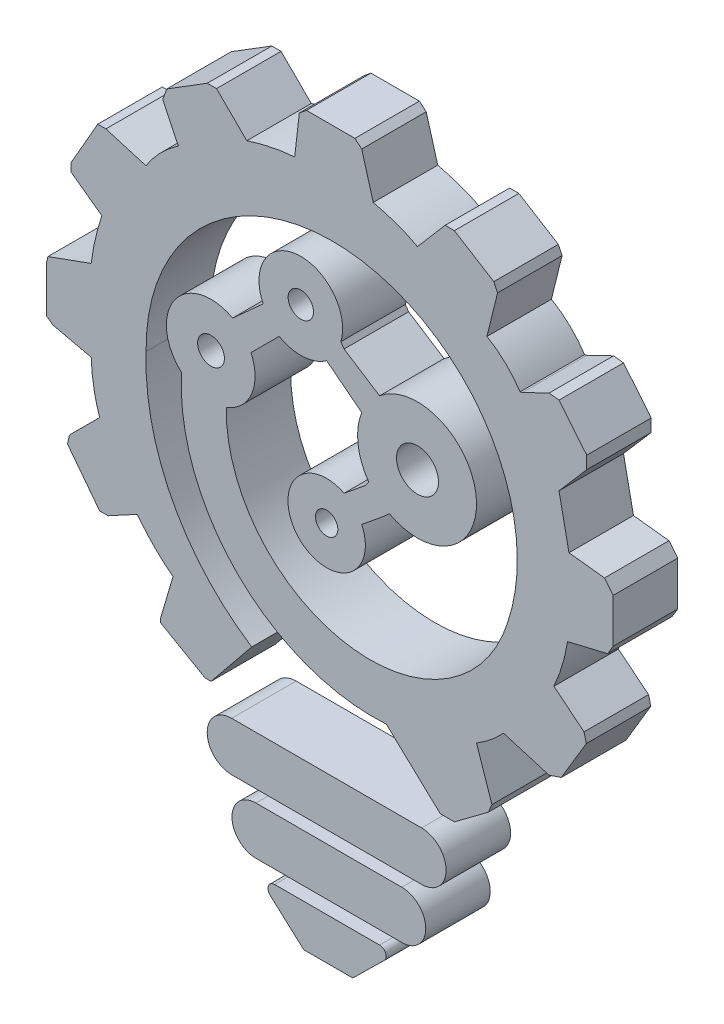
from build123d import *

# Parameters (mm, degrees)
BOSS_EXTRUDE1_DEPTH   = 10
BOSS_EXTRUDE1_2_DEPTH = 10
BOSS_EXTRUDE1_3_DEPTH = 10
SKETCH1_R             = 1.735714146
SKETCH1_R_2           = 3.25388296
SKETCH1_R_3           = 1.963199763
SKETCH1_R_4           = 2.077188844
BOSS_EXTRUDE1_4_DEPTH = 10
CUT_EXTRUDE2_DEPTH    = 3.5


with BuildPart() as part:
    # Sketch1 → Boss-Extrude1 (new body)
    with BuildSketch(Plane.XY):
        with BuildLine():
            Line((36.612676513, 50.128115897), (66.063908948, 50.128115897))
            ThreePointArc((66.063908948, 50.128115897), (69.85606523, 46.335959615), (66.063908948, 42.543803333))
            Line((66.063908948, 42.543803333), (36.612676513, 42.543803333))
            ThreePointArc((36.612676513, 42.543803333), (32.82052023, 46.335959615), (36.612676513, 50.128115897))
        make_face()
    extrude(amount=BOSS_EXTRUDE1_DEPTH)


with BuildPart() as body_2:
    # Sketch1 → Boss-Extrude1 2 (new body)
    with BuildSketch(Plane.XY):
        with BuildLine():
            Line((40.371121954, 40.631857622), (62.992183574, 40.631857622))
            ThreePointArc((62.992183574, 40.631857622), (66.703998638, 36.920042558), (62.992183574, 33.208227494))
            Line((62.992183574, 33.208227494), (40.371121954, 33.208227494))
            ThreePointArc((40.371121954, 33.208227494), (36.65930689, 36.920042558), (40.371121954, 40.631857622))
        make_face()
    extrude(amount=BOSS_EXTRUDE1_2_DEPTH)


with BuildPart() as body_3:
    # Sketch1 → Boss-Extrude1 3 (new body)
    with BuildSketch(Plane.XY):
        with BuildLine():
            Line((43.291590681, 31.145459419), (59.548762461, 31.145459419))
            ThreePointArc((59.548762461, 31.145459419), (60.47915555, 30.526270831), (60.255275906, 29.431326214))
            Line((60.255275906, 29.431326214), (55.380256876, 24.642590707))
            Line((55.380256876, 24.642590707), (47.793576713, 24.642590707))
            Line((47.793576713, 24.642590707), (42.554783621, 29.366497269))
            ThreePointArc((42.554783621, 29.366497269), (42.328835394, 30.502145791), (43.291590681, 31.145459419))
        make_face()
    extrude(amount=BOSS_EXTRUDE1_3_DEPTH)


with BuildPart() as body_4:
    # Sketch1 → Boss-Extrude1 4 (new body)
    with BuildSketch(Plane.XY):
        with BuildLine():
            Line((54.042424699, 89.057178574), (57.338263311, 91.74525403))
            Line((57.338263311, 91.74525403), (57.858109934, 92.482001406))
            ThreePointArc((57.858109934, 92.482001406), (56.203750586, 96.735543385), (56.775287603, 101.263552843))
            Line((56.775287603, 101.263552843), (51.33821868, 105.502853511))
            ThreePointArc((51.33821868, 105.502853511), (47.717753365, 104.214223221), (43.975219744, 105.087022863))
            Line((43.975219744, 105.087022863), (39.619407743, 100.731210862))
            ThreePointArc((39.619407743, 100.731210862), (39.726080925, 95.257490785), (35.780591664, 91.461953256))
            ThreePointArc((35.780591664, 91.461953256), (54.470931261, 69.004961782), (79.367543752, 84.29561078))
            ThreePointArc((79.367543752, 84.29561078), (78.518157241, 104.885379157), (63.999024785, 119.509154728))
            ThreePointArc((63.999024785, 119.509154728), (36.348842887, 117.238880972), (23.350287639, 92.729204038))
            ThreePointArc((23.350287639, 92.729204038), (27.391085677, 74.838212259), (39.726172291, 61.263925027))
            Line((39.726172291, 61.263925027), (33.41222021, 53.484864806))
            Line((33.41222021, 53.484864806), (32.501801001, 53.484864806))
            Line((32.501801001, 53.484864806), (25.600419414, 57.431311375))
            Line((25.600419414, 57.431311375), (25.600419414, 58.091089656))
            Line((25.600419414, 58.091089656), (27.529461306, 64.624845993))
            add(Edge.make_bspline(
                [(27.529461306, 64.624845993), (24.51350433, 66.863878585), (21.96798092, 70.186326379)],
                knots=[0, 0, 0, 1, 1, 1], degree=2))
            Line((21.96798092, 70.186326379), (17.44826512, 67.73638598))
            Line((17.44826512, 67.73638598), (16.147653792, 67.73638598))
            Line((16.147653792, 67.73638598), (11.164001938, 74.227807572))
            Line((11.164001938, 74.227807572), (11.478280842, 75.608236048))
            Line((11.478280842, 75.608236048), (16.147653792, 80.277608998))
            add(Edge.make_bspline(
                [(14.836422664, 87.711108712), (14.969965726, 83.721585295), (16.147653792, 80.277608998)],
                knots=[0, 0, 0, 1, 1, 1], degree=2))
            Line((14.836422664, 87.711108712), (8.923989025, 89.057178574))
            Line((8.923989025, 89.057178574), (7.872310913, 89.823022551))
            Line((7.872310913, 89.823022551), (7.872310913, 96.783792065))
            Line((7.872310913, 96.783792065), (8.120139021, 97.872344214))
            Line((8.120139021, 97.872344214), (14.836422664, 100.309725684))
            ThreePointArc((14.836422664, 100.309725684), (15.482642582, 103.966872263), (16.483280209, 107.543329397))
            Line((16.483280209, 107.543329397), (11.70192116, 111.025169506))
            Line((11.70192116, 111.025169506), (11.70192116, 112.254374343))
            Line((11.70192116, 112.254374343), (15.850453276, 119.509154728))
            Line((15.850453276, 119.509154728), (17.116107143, 119.509154728))
            Line((17.116107143, 119.509154728), (23.350287639, 117.668560326))
            add(Edge.make_bspline(
                [(28.34341676, 122.838084344), (25.083188206, 120.541403415), (23.350287639, 117.668560326)],
                knots=[0, 0, 0, 1, 1, 1], degree=2))
            Line((28.34341676, 122.838084344), (25.924430047, 127.860583288))
            Line((25.924430047, 127.860583288), (26.55905403, 129.601522707))
            Line((26.55905403, 129.601522707), (32.835382419, 133.499504209))
            Line((32.835382419, 133.499504209), (34.268559767, 133.499504209))
            Line((34.268559767, 133.499504209), (38.960915607, 128.841575946))
            add(Edge.make_bspline(
                [(46.383652832, 130.361469468), (43.207748731, 130.193389879), (38.960915607, 128.841575946)],
                knots=[0, 0, 0, 1, 1, 1], degree=2))
            Line((46.383652832, 130.361469468), (47.099801145, 136.637538949))
            Line((47.099801145, 136.637538949), (48.204973985, 137.54371488))
            Line((48.204973985, 137.54371488), (55.716804255, 137.54371488))
            Line((55.716804255, 137.54371488), (56.775287603, 136.637538949))
            Line((56.775287603, 136.637538949), (58.560830407, 130.361469468))
            add(Edge.make_bspline(
                [(65.42141471, 127.860583288), (62.762273281, 129.346820645), (58.560830407, 130.361469468)],
                knots=[0, 0, 0, 1, 1, 1], degree=2))
            Line((65.42141471, 127.860583288), (69.703471426, 132.862355649))
            Line((69.703471426, 132.862355649), (71.141353612, 132.862355649))
            Line((71.141353612, 132.862355649), (77.253367018, 129.076282377))
            Line((77.253367018, 129.076282377), (77.838884302, 127.860583288))
            Line((77.838884302, 127.860583288), (76.183025885, 121.169766859))
            add(Edge.make_bspline(
                [(76.183025885, 121.169766859), (79.253811261, 119.413315061), (81.326289538, 116.311143396)],
                knots=[0, 0, 0, 1, 1, 1], degree=2))
            Line((81.326289538, 116.311143396), (81.695672628, 116.410742944))
            Line((81.695672628, 116.410742944), (85.815355288, 118.394906151))
            Line((85.815355288, 118.394906151), (87.360330483, 118.218612472))
            Line((87.360330483, 118.218612472), (91.659132082, 112.975790841))
            Line((91.659132082, 112.975790841), (91.659132082, 111.025169506))
            Line((91.659132082, 111.025169506), (87.360330483, 106.045624317))
            Line((87.360330483, 106.045624317), (88.905274365, 98.500548104))
            Line((88.905274365, 98.500548104), (94.4129898, 97.87207496))
            Line((94.4129898, 97.87207496), (95.767055319, 96.21186062))
            Line((95.767055319, 96.21186062), (95.767055319, 89.382694603))
            Line((95.767055319, 89.382694603), (94.909859849, 87.946746758))
            Line((94.909859849, 87.946746758), (88.683296287, 86.458456895))
            add(Edge.make_bspline(
                [(88.683296287, 86.458456895), (88.100618882, 82.748375774), (86.564981896, 79.397644229)],
                knots=[0, 0, 0, 1, 1, 1], degree=2))
            Line((86.564981896, 79.397644229), (91.245566834, 75.624301928))
            Line((91.245566834, 75.624301928), (91.598019479, 74.227807572))
            Line((91.598019479, 74.227807572), (87.722936412, 67.73638598))
            Line((87.722936412, 67.73638598), (85.815355288, 67.093511057))
            Line((85.815355288, 67.093511057), (78.775745724, 69.205464306))
            add(Edge.make_bspline(
                [(78.775745724, 69.205464306), (76.888993362, 67.188035301), (74.572909919, 65.777644834)],
                knots=[0, 0, 0, 1, 1, 1], degree=2))
            Line((74.572909919, 65.777644834), (76.954362748, 58.711239992))
            Line((76.954362748, 58.711239992), (76.421059157, 57.431311375))
            Line((76.421059157, 57.431311375), (71.141353612, 53.484864806))
            Line((71.141353612, 53.484864806), (68.954808891, 53.484864806))
            Line((68.954808891, 53.484864806), (60.578889007, 61.332051704))
            ThreePointArc((60.578889007, 61.332051704), (37.638360698, 69.85475845), (28.834470871, 92.688853424))
            ThreePointArc((28.834470871, 92.688853424), (27.758447656, 101.854708046), (36.751263907, 103.928345615))
            Line((36.751263907, 103.928345615), (41.493079417, 108.204751423))
            ThreePointArc((41.493079417, 108.204751423), (46.823385651, 117.490522776), (53.542937831, 109.154736511))
            Line((53.542937831, 109.154736511), (54.042232948, 108.423261616))
            Line((54.042232948, 108.423261616), (59.548581239, 104.89051106))
            ThreePointArc((59.548581239, 104.89051106), (74.526662809, 98.789825799), (61.067178135, 89.823022551))
            Line((61.067178135, 89.823022551), (60.090678716, 88.942366655))
            Line((60.090678716, 88.942366655), (56.775372182, 86.238413225))
            ThreePointArc((56.775372182, 86.238413225), (47.03062353, 79.524599219), (54.042424699, 89.057178574))
        make_face()
        with Locations((51.33830326, 83.70113079)):
            Circle(SKETCH1_R, mode=Mode.SUBTRACT)
        with Locations((65.42141471, 97.872141243)):
            Circle(SKETCH1_R_2, mode=Mode.SUBTRACT)
        with Locations((47.333100287, 111.025169506)):
            Circle(SKETCH1_R_3, mode=Mode.SUBTRACT)
        with Locations((33.41222021, 97.872344214)):
            Circle(SKETCH1_R_4, mode=Mode.SUBTRACT)
    extrude(amount=BOSS_EXTRUDE1_4_DEPTH)

    # Sketch2 → Cut-Extrude2 (cut)
    with BuildSketch(Plane(origin=(0, 0, 0), x_dir=(-1, 0, 0), z_dir=(0, 0, -1))):
        with BuildLine():
            Line((-36.882576832, 101.353568923), (-42.290231098, 106.230461342))
            Line((-42.290231098, 106.230461342), (-37.080357203, 101.020587447))
            ThreePointArc((-37.080357203, 101.020587447), (-37.893710893, 96.06046516), (-33.861615538, 93.059371298))
            ThreePointArc((-33.861615538, 93.059371298), (-53.367472026, 67.172595862), (-81.267551741, 83.670751264))
            ThreePointArc((-81.267551741, 83.670751264), (-80.346652287, 105.695765365), (-64.812170652, 121.336391385))
            ThreePointArc((-64.812170652, 121.336391385), (-35.268906863, 118.922417224), (-21.349861224, 92.751978269))
            ThreePointArc((-21.349861224, 92.751978269), (-25.129717063, 74.884715442), (-36.81226348, 60.847461425))
            Line((-36.81226348, 60.847461425), (-32.641490793, 55.708890291))
            Line((-32.641490793, 55.708890291), (-27.799852639, 58.477504958))
            Line((-27.799852639, 58.477504958), (-29.856074316, 65.442025158))
            add(Edge.make_bspline(
                [(-29.856074316, 65.442025158), (-29.175521421, 65.883970458), (-27.879064513, 66.83183634), (-26.00235788, 68.531221621), (-24.519885547, 70.169582429), (-23.383769421, 71.61199016), (-22.824457002, 72.38961669), (-22.555784216, 72.779877494)],
                knots=[0.500282491, 0.500282491, 0.500282491, 0.500282491, 0.500474616, 0.500666741, 0.500858866, 0.500954928, 0.501050991, 0.501050991, 0.501050991, 0.501050991], degree=3))
            Line((-22.555784216, 72.779877494), (-17.0770441, 69.810091883))
            Line((-17.0770441, 69.810091883), (-13.355732604, 74.657260685))
            Line((-13.355732604, 74.657260685), (-18.472416218, 79.773944264))
            add(Edge.make_bspline(
                [(-18.472416218, 79.773944264), (-18.180879786, 80.48416116), (-17.682088455, 81.925076377), (-17.152529334, 84.237432109), (-16.903073855, 86.281021736), (-16.819114201, 87.983569854), (-16.816446117, 88.87065466), (-16.824762225, 89.309605882)],
                knots=[0.500152836, 0.500152836, 0.500152836, 0.500152836, 0.500341207, 0.500529579, 0.500717951, 0.500812137, 0.500906323, 0.500906323, 0.500906323, 0.500906323], degree=3))
            Line((-16.824762225, 89.309605882), (-9.872310913, 90.892454127))
            Line((-9.872310913, 90.892454127), (-9.872310913, 96.380589694))
            Line((-9.872310913, 96.380589694), (-16.688696078, 98.854298633))
            ThreePointArc((-16.688696078, 98.854298633), (-17.459873001, 103.641146011), (-18.868263889, 108.280656412))
            Line((-18.868263889, 108.280656412), (-13.83108217, 111.948789503))
            Line((-13.83108217, 111.948789503), (-16.984161581, 117.462763608))
            Line((-16.984161581, 117.462763608), (-24.362840661, 115.284264699))
            add(Edge.make_bspline(
                [(-24.362840661, 115.284264699), (-24.646652824, 115.933709084), (-25.322213081, 117.159331227), (-26.734958109, 118.921539462), (-28.263474131, 120.307897606), (-29.694417524, 121.359457035), (-30.504172759, 121.879036013), (-30.908098275, 122.122180546)],
                knots=[0.500066259, 0.500066259, 0.500066259, 0.500066259, 0.50030451, 0.500542761, 0.500781012, 0.500900138, 0.501019263, 0.501019263, 0.501019263, 0.501019263], degree=3))
            Line((-30.908098275, 122.122180546), (-28.092433001, 127.968296092))
            Line((-28.092433001, 127.968296092), (-28.20138546, 128.267181157))
            Line((-28.20138546, 128.267181157), (-33.405905009, 131.499504209))
            Line((-33.405905009, 131.499504209), (-33.444443051, 131.499504209))
            Line((-33.444443051, 131.499504209), (-38.424034638, 126.556447474))
            add(Edge.make_bspline(
                [(-38.424034638, 126.556447474), (-38.923711949, 126.728684385), (-39.951259542, 127.065423843), (-41.843524077, 127.61415179), (-44.028521179, 128.110611382), (-45.919655934, 128.349957825), (-47.272276607, 128.396300717), (-47.862527424, 128.375584423), (-48.167409158, 128.352648043)],
                knots=[0.498388849, 0.498388849, 0.498388849, 0.498388849, 0.498504097, 0.498619345, 0.498849841, 0.499080336, 0.499195584, 0.499310832, 0.499310832, 0.499310832, 0.499310832], degree=3))
            Line((-48.167409158, 128.352648043), (-48.98796579, 135.54371488))
            Line((-48.98796579, 135.54371488), (-54.977634657, 135.54371488))
            Line((-54.977634657, 135.54371488), (-55.016607432, 135.51034998))
            Line((-55.016607432, 135.51034998), (-56.961233789, 128.675111375))
            add(Edge.make_bspline(
                [(-56.961233789, 128.675111375), (-57.464027583, 128.566846208), (-58.490262419, 128.328466938), (-60.333224179, 127.828546009), (-62.377183896, 127.133223702), (-64.025150243, 126.370532014), (-65.124626428, 125.721214295), (-65.576552985, 125.405761049), (-65.803735329, 125.231839517)],
                knots=[0.498448059, 0.498448059, 0.498448059, 0.498448059, 0.498564687, 0.498681315, 0.498914572, 0.499147829, 0.499264457, 0.499381086, 0.499381086, 0.499381086, 0.499381086], degree=3))
            Line((-65.803735329, 125.231839517), (-70.606053504, 130.841317314))
            Line((-70.606053504, 130.841317314), (-75.704481358, 127.683107385))
            Line((-75.704481358, 127.683107385), (-75.724393252, 127.641764675))
            Line((-75.724393252, 127.641764675), (-73.857837803, 120.099586634))
            add(Edge.make_bspline(
                [(-73.857837803, 120.099586634), (-74.541582528, 119.803442256), (-75.874683158, 119.090225533), (-77.595265055, 117.741920573), (-78.864618446, 116.344789805), (-79.772400534, 115.062979337), (-80.200086859, 114.348519017), (-80.397886573, 113.989382219)],
                knots=[0.499682977, 0.499682977, 0.499682977, 0.499682977, 0.499917437, 0.500151898, 0.500386359, 0.50050359, 0.50062082, 0.50062082, 0.50062082, 0.50062082], degree=3))
            Line((-80.397886573, 113.989382219), (-82.395941522, 114.528132845))
            Line((-82.395941522, 114.528132845), (-86.162659389, 116.34229758))
            Line((-86.162659389, 116.34229758), (-86.327907229, 116.323441517))
            Line((-86.327907229, 116.323441517), (-89.659132082, 112.260677206))
            Line((-89.659132082, 112.260677206), (-89.659132082, 111.76903796))
            Line((-89.659132082, 111.76903796), (-85.203674476, 106.608029253))
            Line((-85.203674476, 106.608029253), (-87.236979083, 96.67793509))
            Line((-87.236979083, 96.67793509), (-93.377553642, 95.977247801))
            Line((-93.377553642, 95.977247801), (-93.767055319, 95.499681347))
            Line((-93.767055319, 95.499681347), (-93.767055319, 89.934248869))
            Line((-93.767055319, 89.934248869), (-93.624785781, 89.695923256))
            Line((-93.624785781, 89.695923256), (-86.880583793, 88.083906073))
            add(Edge.make_bspline(
                [(-86.880583793, 88.083906073), (-86.793282577, 87.265096209), (-86.541207507, 85.621978009), (-85.946675868, 83.278937952), (-85.13382938, 81.017695887), (-84.440269594, 79.557543904), (-84.0602914, 78.847872764)],
                knots=[0.499526309, 0.499526309, 0.499526309, 0.499526309, 0.499704733, 0.499883157, 0.500061581, 0.500240005, 0.500240005, 0.500240005, 0.500240005], degree=3))
            Line((-84.0602914, 78.847872764), (-89.438495275, 74.512131731))
            Line((-89.438495275, 74.512131731), (-86.384253109, 69.395757914))
            Line((-86.384253109, 69.395757914), (-85.780104848, 69.192153589))
            Line((-85.780104848, 69.192153589), (-78.120866305, 71.490001727))
            add(Edge.make_bspline(
                [(-78.120866305, 71.490001727), (-77.70493696, 70.985012906), (-76.813481759, 70.007181831), (-75.383303928, 68.738229754), (-73.836976644, 67.634539742), (-72.716715394, 67.005220365), (-72.144124713, 66.722015581)],
                knots=[0.499572208, 0.499572208, 0.499572208, 0.499572208, 0.499740941, 0.499909675, 0.500078408, 0.500247141, 0.500247141, 0.500247141, 0.500247141], degree=3))
            Line((-72.144124713, 66.722015581), (-74.818735212, 58.785733908))
            Line((-74.818735212, 58.785733908), (-74.785364314, 58.705643751))
            Line((-74.785364314, 58.705643751), (-70.476484374, 55.484864806))
            Line((-70.476484374, 55.484864806), (-69.745318874, 55.484864806))
            Line((-69.745318874, 55.484864806), (-61.298146946, 63.398805937))
            ThreePointArc((-61.298146946, 63.398805937), (-38.969943576, 71.350920957), (-30.910982586, 93.64078293))
            ThreePointArc((-30.910982586, 93.64078293), (-29.525503748, 100.881619161), (-36.882576832, 101.353568923))
        make_face()
    extrude(amount=-CUT_EXTRUDE2_DEPTH, mode=Mode.SUBTRACT)


solid = Compound([part.part, body_2.part, body_3.part, body_4.part])
